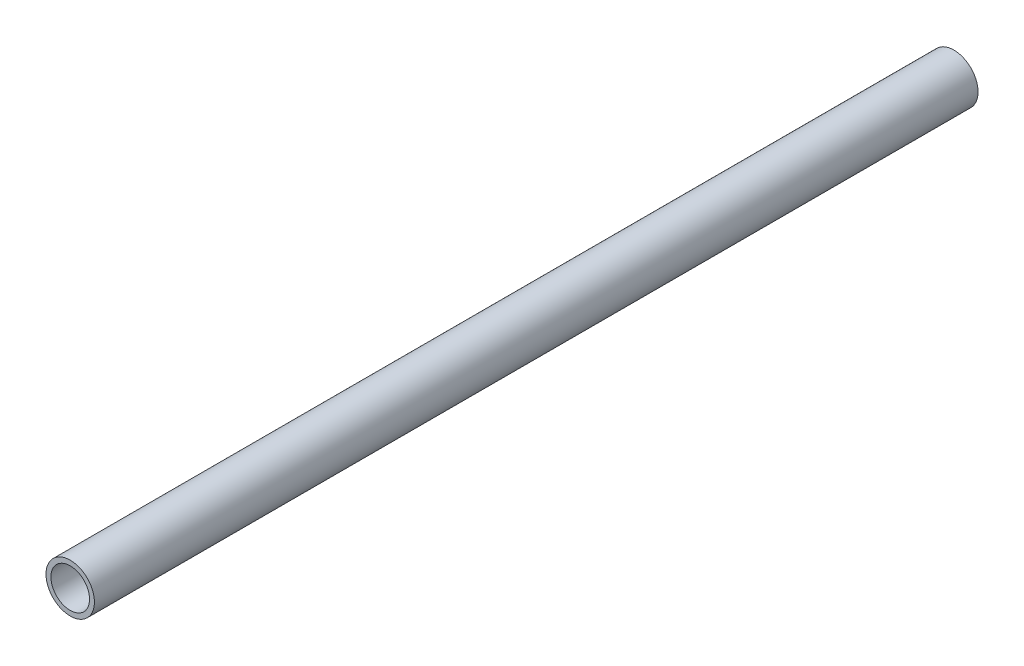
from build123d import *

# Parameters (mm, degrees)
SKETCH1_R           = 16.7005
SKETCH1_R_2         = 13.3223
BOSS_EXTRUDE1_DEPTH = 609.6


with BuildPart() as part:
    # Sketch1 → Boss-Extrude1 (new body)
    with BuildSketch(Plane.XY):
        with Locations(Location((0, 0, 0), (0, 0, 180))):
            Circle(SKETCH1_R)
        with Locations(Location((0, 0, 0), (0, 0, 180))):
            Circle(SKETCH1_R_2, mode=Mode.SUBTRACT)
    extrude(amount=BOSS_EXTRUDE1_DEPTH)


solid = part.part
